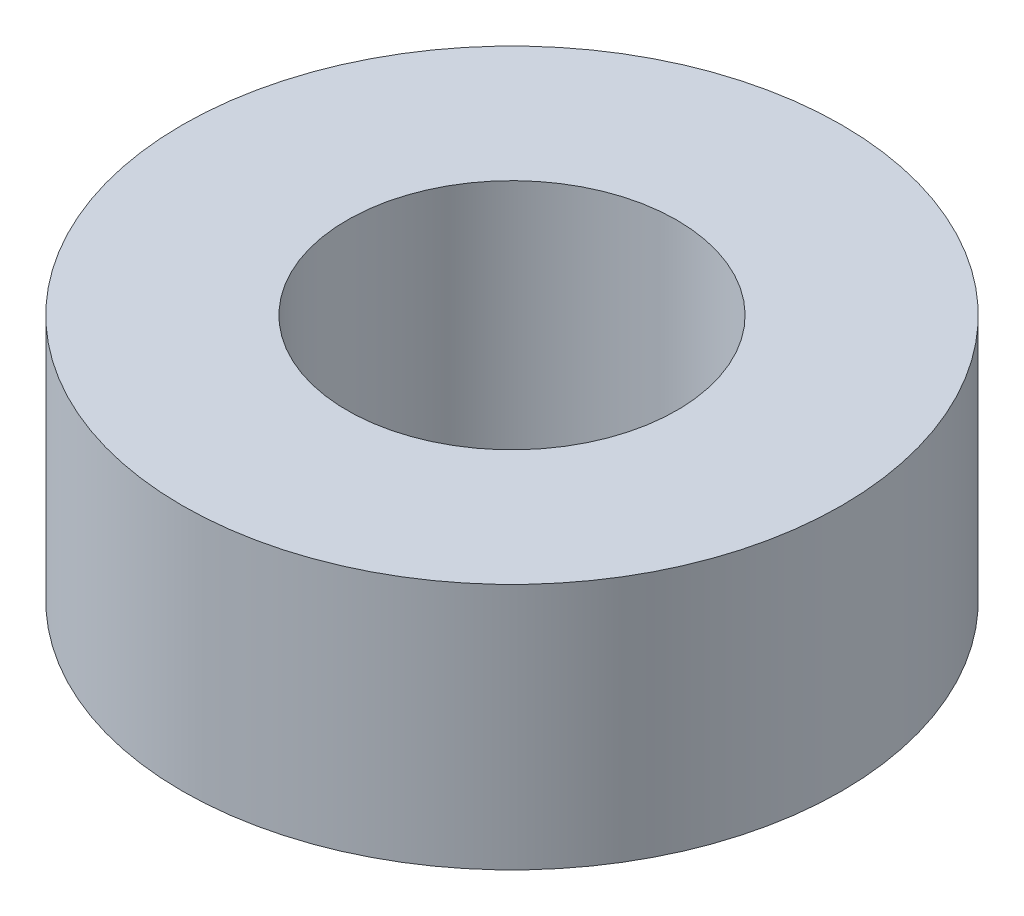
from build123d import *

# Parameters (mm, degrees)
SKETCH1_R           = 6.35
SKETCH1_R_2         = 3.175
BOSS_EXTRUDE1_DEPTH = 4.7625


with BuildPart() as part:
    # Sketch1 → Boss-Extrude1 (new body)
    with BuildSketch(Plane(origin=(0, 0, 0), x_dir=(1, 0, 0), z_dir=(0, 1, 0))):
        with Locations(Location((0, 0, 0), (0, 0, 90))):
            Circle(SKETCH1_R)
        with Locations(Location((0, 0, 0), (0, 0, 90))):
            Circle(SKETCH1_R_2, mode=Mode.SUBTRACT)
    extrude(amount=BOSS_EXTRUDE1_DEPTH)


solid = part.part
